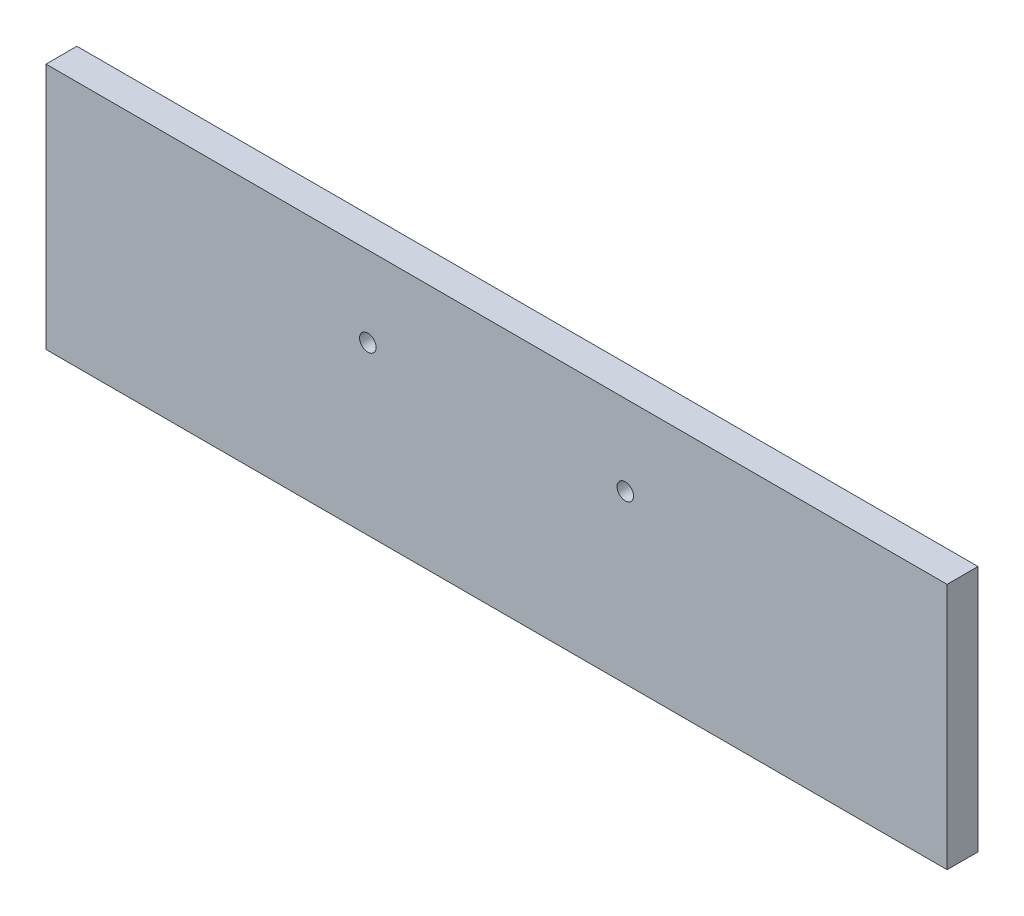
from build123d import *

# Parameters (mm, degrees)
SKETCH1_W           = 175
SKETCH1_H           = 48
SKETCH1_R           = 1.6
BOSS_EXTRUDE1_DEPTH = 6


with BuildPart() as part:
    # Sketch1 → Boss-Extrude1 (new body)
    with BuildSketch(Plane.XY):
        Rectangle(SKETCH1_W, SKETCH1_H)
        with Locations((-25, 8.4)):
            Circle(SKETCH1_R, mode=Mode.SUBTRACT)
        with Locations(Location((25, 8.4, 0), (0, 0, 180))):
            Circle(SKETCH1_R, mode=Mode.SUBTRACT)
    extrude(amount=BOSS_EXTRUDE1_DEPTH)


solid = part.part
